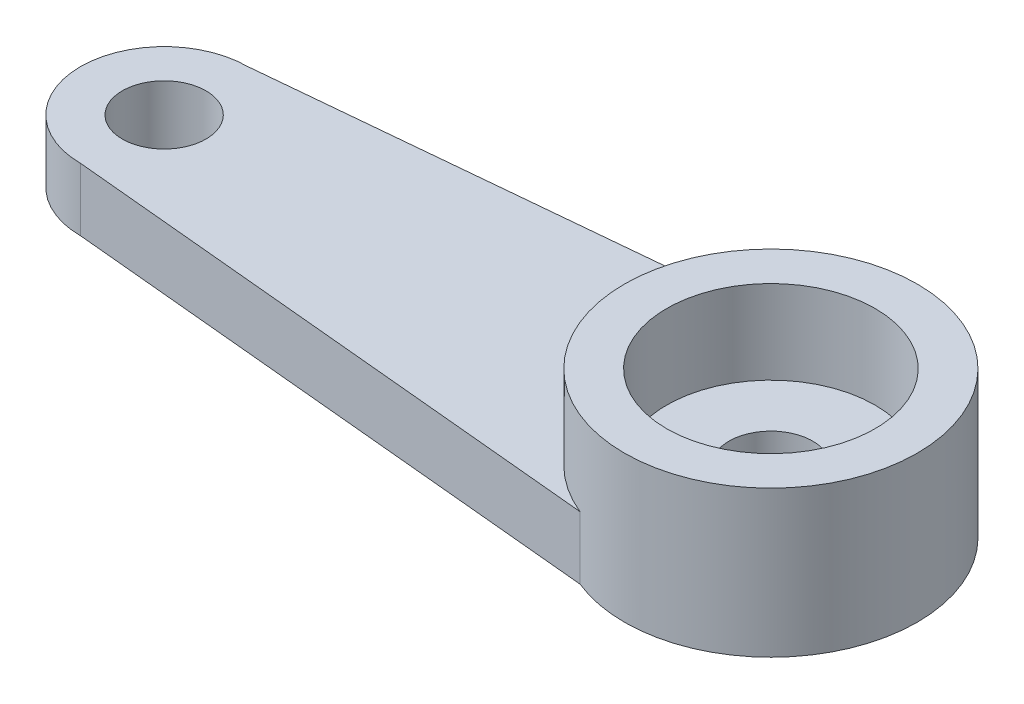
from build123d import *

# Parameters (mm, degrees)
SKETCH_1_R      = 1
EXTRUDE_1_DEPTH = 1.5
SKETCH_3_R      = 3.5
SKETCH_3_R_2    = 2.490413186
EXTRUDE_2_DEPTH = 2


with BuildPart() as part:
    # 草图1 → 凸台-拉伸1 (new body)
    with BuildSketch(Plane(origin=(0, 0, 0), x_dir=(1, 0, 0), z_dir=(0, 1, 0))):
        with BuildLine():
            Line((-14.5, 2), (-1.319677425, 3.241674181))
            ThreePointArc((-1.319677425, 3.241674181), (3.5, 0), (-1.319677425, -3.241674181))
            Line((-1.319677425, -3.241674181), (-14.5, -2))
            ThreePointArc((-14.5, -2), (-16.5, 0), (-14.5, 2))
        make_face()
        with Locations(Location((-14.5, 0, 0), (0, 0, 270))):
            Circle(SKETCH_1_R, mode=Mode.SUBTRACT)
        with Locations(Location((0, 0, 0), (0, 0, 270))):
            Circle(SKETCH_1_R, mode=Mode.SUBTRACT)
    extrude(amount=EXTRUDE_1_DEPTH)

    # 草图3 → 凸台-拉伸2 (add)
    with BuildSketch(Plane(origin=(0, 1.5, 0), x_dir=(1, 0, 0), z_dir=(0, 1, 0))):
        with Locations(Location((0, 0, 0), (0, 0, 112.151115012))):
            Circle(SKETCH_3_R)
        with Locations(Location((0, 0, 0), (0, 0, 270))):
            Circle(SKETCH_3_R_2, mode=Mode.SUBTRACT)
    extrude(amount=EXTRUDE_2_DEPTH)


solid = part.part
